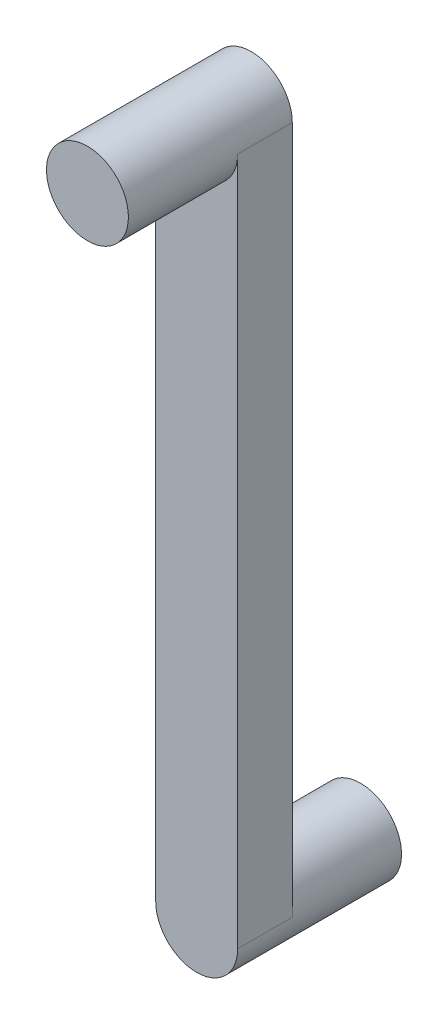
from build123d import *

# Parameters (mm, degrees)
EXTRUDE_1_DEPTH = 10
SKETCH_2_R      = 7.5
EXTRUDE_2_DEPTH = 20
EXTRUDE_START   = 20
SKETCH_3_R      = 7.5
EXTRUDE_3_DEPTH = 20


with BuildPart() as part:
    # 草图1 → 凸台-拉伸1 (new body)
    with BuildSketch(Plane.XY):
        with BuildLine():
            Line((7.5, 0), (7.5, -126))
            ThreePointArc((7.5, -126), (0, -133.5), (-7.5, -126))
            Line((-7.5, -126), (-7.5, 0))
            ThreePointArc((-7.5, 0), (0, 7.5), (7.5, 0))
        make_face()
    extrude(amount=EXTRUDE_1_DEPTH)

    # 草图2 → 凸台-拉伸2 (add)
    with BuildSketch(Plane.XY.offset(10)):
        Circle(SKETCH_2_R)
    extrude(amount=EXTRUDE_2_DEPTH)

    # 草图3 → 凸台-拉伸3 (add)
    with BuildSketch(Plane(origin=(0, 0, 0), x_dir=(-1, 0, 0), z_dir=(0, 0, -1)).offset(EXTRUDE_START)):
        with Locations((0, -126)):
            Circle(SKETCH_3_R)
    extrude(amount=-EXTRUDE_3_DEPTH)


solid = part.part
